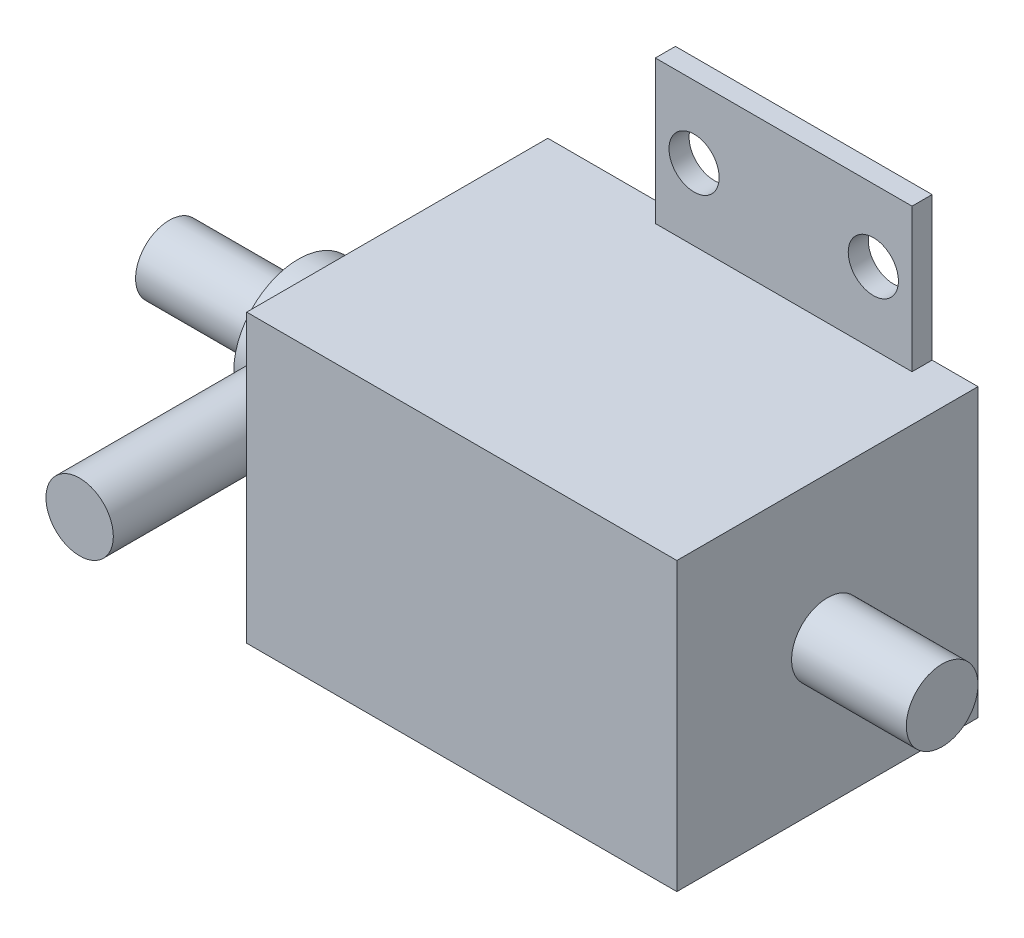
from build123d import *

# Parameters (mm, degrees)
SKETCH1_W                            = 30
SKETCH1_H                            = 20
BOSS_EXTRUDE1_DEPTH                  = 21
SKETCH2_W                            = 17.9
SKETCH2_H                            = 1.4
BOSS_EXTRUDE2_DEPTH                  = 10
SKETCH3_R                            = 2.5
BOSS_EXTRUDE3_DEPTH                  = 8
SKETCH4_R                            = 4.5
BOSS_EXTRUDE4_DEPTH                  = 6.9
SKETCH5_R                            = 2.35
BOSS_EXTRUDE5_DEPTH                  = 9
SKETCH7_R                            = 2.35
BOSS_EXTRUDE6_DEPTH                  = 14.2
BOSS_EXTRUDE6_DIRECTION_2_REACH      = 53.391
BOSS_EXTRUDE6_DIRECTION_2_END_RADIUS = 4.5
SKETCH8_2_R                          = 1.75
CUT_EXTRUDE1_DEPTH                   = 56.828666472


with BuildPart() as part:
    # Sketch1 → Boss-Extrude1 (new body)
    with BuildSketch(Plane.XY):
        with Locations((15, 10)):
            Rectangle(SKETCH1_W, SKETCH1_H)
    extrude(amount=BOSS_EXTRUDE1_DEPTH)

    # Sketch2 → Boss-Extrude2 (add)
    with BuildSketch(Plane(origin=(0, 20, 0), x_dir=(1, 0, 0), z_dir=(0, 1, 0))):
        with Locations((17.85, -0.7)):
            Rectangle(SKETCH2_W, SKETCH2_H)
    extrude(amount=BOSS_EXTRUDE2_DEPTH)

    # Sketch3 → Boss-Extrude3 (add)
    with BuildSketch(Plane(origin=(30, 0, 0), x_dir=(0, 0, -1), z_dir=(1, 0, 0))):
        with Locations((-10.5, 10)):
            Circle(SKETCH3_R)
    extrude(amount=BOSS_EXTRUDE3_DEPTH)

    # Sketch4 → Boss-Extrude4 (add)
    with BuildSketch(Plane.ZY):
        with Locations((10.5, 10)):
            Circle(SKETCH4_R)
    extrude(amount=BOSS_EXTRUDE4_DEPTH)

    # Sketch5 → Boss-Extrude5 (add)
    with BuildSketch(Plane.ZY.offset(6.9)):
        with Locations((10.5, 10)):
            Circle(SKETCH5_R)
    extrude(amount=BOSS_EXTRUDE5_DEPTH)

    # Sketch7 → Boss-Extrude6 (add)
    with BuildSketch(Plane(origin=(-6.9, 10, 15), x_dir=(1, 0, 0), z_dir=(0, 0, 1))):
        with Locations((3.45, 0)):
            Circle(SKETCH7_R)
    extrude(amount=BOSS_EXTRUDE6_DEPTH)

    # Boss-Extrude6 direction 2: up to this cylinder (the profile starts outside it)
    boss_extrude6_direction_2_end = Plane(origin=(-3.45, 10, 10.5), z_dir=(1, 0, 0)) * Cylinder(BOSS_EXTRUDE6_DIRECTION_2_END_RADIUS, 116.782, mode=Mode.PRIVATE)
    # Sketch7 → Boss-Extrude6 direction 2 (add, up to the surface)
    with BuildSketch(Plane(origin=(-6.9, 10, 15), x_dir=(1, 0, 0), z_dir=(0, 0, 1)), mode=Mode.PRIVATE) as boss_extrude6_direction_2_sk1:
        with Locations((3.45, 0)):
            Circle(SKETCH7_R)
    boss_extrude6_direction_2_tool1 = extrude(boss_extrude6_direction_2_sk1.sketch, amount=-BOSS_EXTRUDE6_DIRECTION_2_REACH, mode=Mode.PRIVATE) - boss_extrude6_direction_2_end
    add(boss_extrude6_direction_2_tool1.solids().sort_by_distance((-3.45, 10, 15))[0])
    add(boss_extrude6_direction_2_tool1.solids().sort_by_distance((-3.45, 10, 15))[1])

    # Sketch8<2> → Cut-Extrude1 (cut, through all)
    with BuildSketch(Plane.XY.offset(1.4)):
        with Locations((11.6, 25)):
            Circle(SKETCH8_2_R)
        with Locations((24.1, 25)):
            Circle(SKETCH8_2_R)
    extrude(amount=-CUT_EXTRUDE1_DEPTH, mode=Mode.SUBTRACT)


solid = part.part
